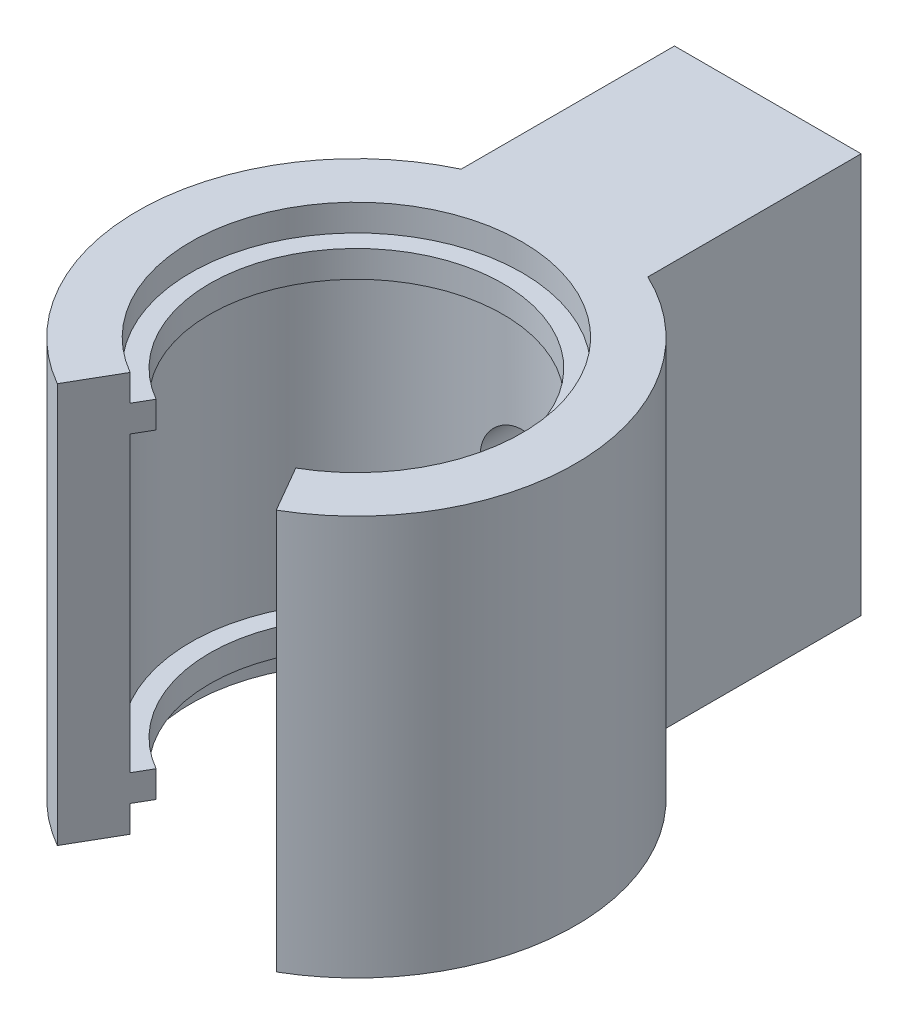
from build123d import *

# Parameters (mm, degrees)
SKETCH1_R               = 6.211279156
BOSS_EXTRUDE1_DEPTH     = 15
CUT_EXTRUDE1_DEPTH      = 24.031459486
CUT_EXTRUDE1_DEPTH_BACK = 24.031459486
BOSS_EXTRUDE3_DEPTH     = 1
SKETCH6_R               = 1.4
CUT_EXTRUDE2_DEPTH      = 10


with BuildPart() as part:
    # Sketch1 → Boss-Extrude1 (new body)
    with BuildSketch(Plane(origin=(0, 0, 0), x_dir=(1, 0, 0), z_dir=(0, 1, 0))):
        with BuildLine():
            Line((-3.5, 7.427994707), (-3.5, 15.427994707))
            Line((-3.5, 15.427994707), (3.5, 15.427994707))
            Line((3.5, 15.427994707), (3.5, 7.427994707))
            ThreePointArc((3.5, 7.427994707), (0, -8.211279156), (-3.5, 7.427994707))
        make_face()
        with Locations(Location((0, 0, 0), (0, 0, 270))):
            Circle(SKETCH1_R, mode=Mode.SUBTRACT)
    extrude(amount=BOSS_EXTRUDE1_DEPTH)

    # Sketch4 → Cut-Extrude1 (cut, two sides: drawn at the far end of the back side and taken through both)
    with BuildSketch(Plane(origin=(0, 15, 0), x_dir=(1, 0, 0), z_dir=(0, 1, 0)).offset(-CUT_EXTRUDE1_DEPTH_BACK)):
        with BuildLine():
            Line((-3.105639578, -5.379125539), (-4.105639578, -7.111176346))
            ThreePointArc((-4.105639578, -7.111176346), (0, -8.211279156), (4.105639578, -7.111176346))
            Line((4.105639578, -7.111176346), (3.105639578, -5.379125539))
            ThreePointArc((3.105639578, -5.379125539), (0, -6.211279156), (-3.105639578, -5.379125539))
        make_face()
    extrude(amount=CUT_EXTRUDE1_DEPTH + CUT_EXTRUDE1_DEPTH_BACK, mode=Mode.SUBTRACT)

    # Sketch5 → Boss-Extrude3 (add)
    with BuildSketch(Plane(origin=(0, 1, 0), x_dir=(-1, 0, 0), z_dir=(0, -1, 0))):
        with BuildLine():
            Line((3.105639578, -5.379125539), (2.749999992, -4.763139708))
            ThreePointArc((2.749999992, -4.763139708), (0, 5.499999985), (-2.749999992, -4.763139708))
            Line((-2.749999992, -4.763139708), (-3.105639578, -5.379125539))
            ThreePointArc((-3.105639578, -5.379125539), (0, 6.211279156), (3.105639578, -5.379125539))
        make_face()
    boss_extrude3 = extrude(amount=-BOSS_EXTRUDE3_DEPTH)

    # Mirror1: Boss-Extrude3 across plane
    add(boss_extrude3.mirror(Plane.ZX.offset(7.5)))

    # Sketch6 → Cut-Extrude2 (cut)
    with BuildSketch(Plane(origin=(0, 0, -15.427994707), x_dir=(-1, 0, 0), z_dir=(0, 0, -1))):
        with Locations((0, 7.5)):
            Circle(SKETCH6_R)
    extrude(amount=-CUT_EXTRUDE2_DEPTH, mode=Mode.SUBTRACT)


solid = part.part
